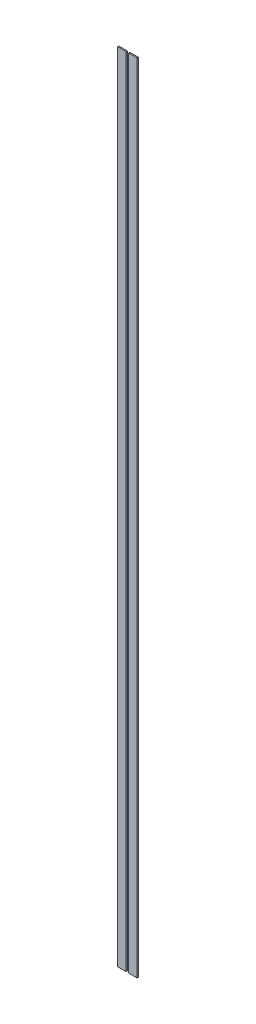
from build123d import *

# Parameters (mm, degrees)
ESQUISSE1_W        = 7
ESQUISSE1_H        = 660
EXTRUSION1_DEPTH   = 1
EXTRUSION1_2_DEPTH = 1


with BuildPart() as part:
    # Esquisse1 → Extrusion1 (new body)
    with BuildSketch(Plane.XY):
        with Locations((4.5, 50)):
            Rectangle(ESQUISSE1_W, ESQUISSE1_H)
    extrude(amount=EXTRUSION1_DEPTH)


with BuildPart() as body_2:
    # Esquisse1 → Extrusion1 2 (new body)
    with BuildSketch(Plane.XY):
        with Locations((-4.5, 50)):
            Rectangle(ESQUISSE1_W, ESQUISSE1_H)
    extrude(amount=EXTRUSION1_2_DEPTH)


solid = Compound([part.part, body_2.part])
